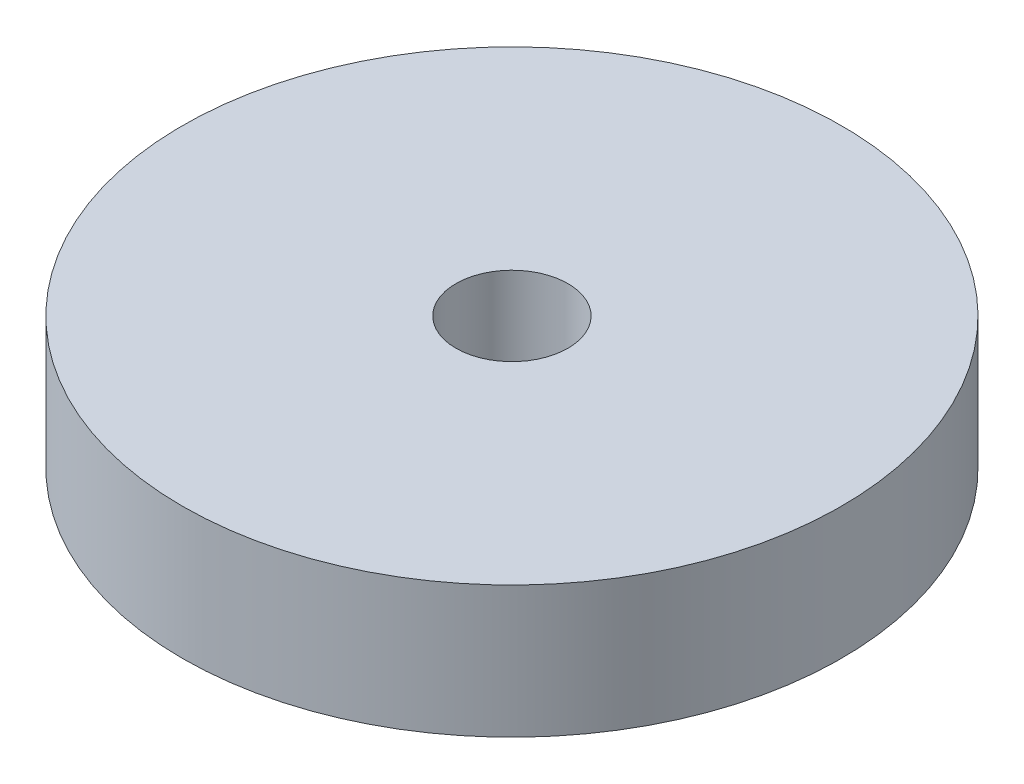
from build123d import *

# Parameters (mm, degrees)
SKETCH1_R           = 25
SKETCH1_R_2         = 4.25
BOSS_EXTRUDE1_DEPTH = 10


with BuildPart() as part:
    # Sketch1 → Boss-Extrude1 (new body)
    with BuildSketch(Plane(origin=(0, 0, 0), x_dir=(1, 0, 0), z_dir=(0, 1, 0))):
        with Locations(Location((0, 0, 0), (0, 0, 270))):
            Circle(SKETCH1_R)
        with Locations(Location((0, 0, 0), (0, 0, 270))):
            Circle(SKETCH1_R_2, mode=Mode.SUBTRACT)
    extrude(amount=BOSS_EXTRUDE1_DEPTH)


solid = part.part
